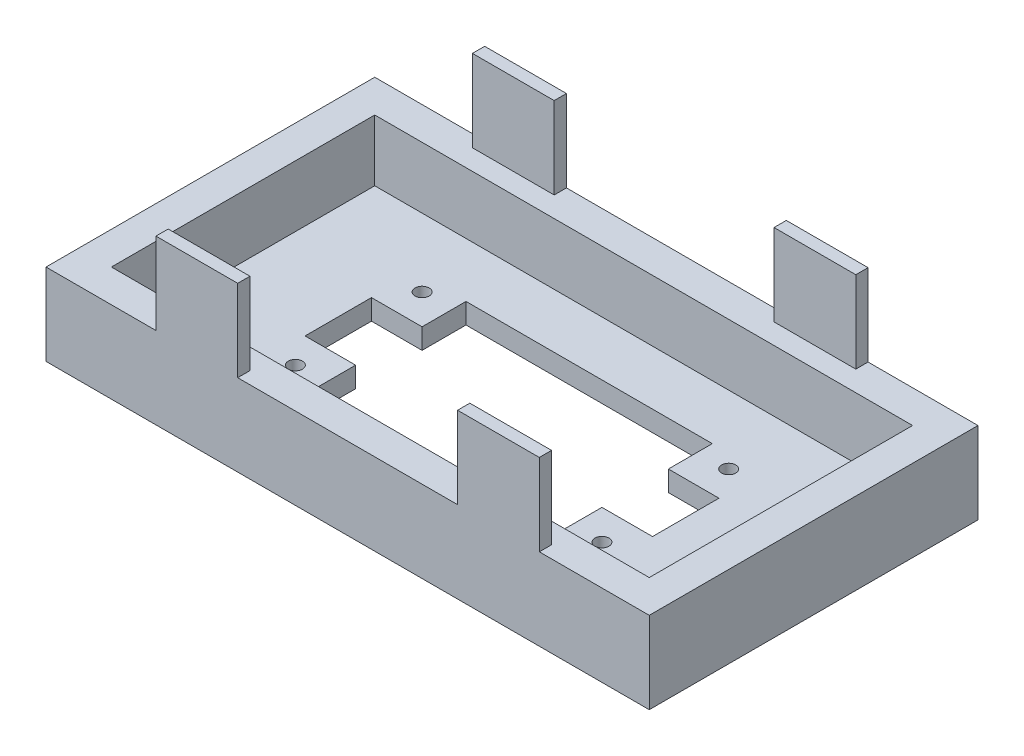
from build123d import *

# Parameters (mm, degrees)
SKETCH1_W                                           = 147.57
SKETCH1_H                                           = 80.42
BOSS_EXTRUDE1_DEPTH                                 = 20
SKETCH2_W                                           = 131.57
SKETCH2_H                                           = 64.42
CUT_EXTRUDE1_DEPTH                                  = 15
CBORE_FOR_4_BINDING_HEAD_MACHINE_SCREW1_D           = 3.4544
CBORE_FOR_4_BINDING_HEAD_MACHINE_SCREW1_CBORE_D     = 6.74624
CBORE_FOR_4_BINDING_HEAD_MACHINE_SCREW1_CBORE_DEPTH = 1.7272
CUT_EXTRUDE2_DEPTH                                  = 170.246215024
SKETCH6_W                                           = 20
SKETCH6_H                                           = 3
BOSS_EXTRUDE2_DEPTH                                 = 20
MIRROR2_COPY_1_SKETCH_W                             = 20
MIRROR2_COPY_1_SKETCH_H                             = 3
MIRROR2_COPY_1_DEPTH                                = 20


with BuildPart() as part:
    # Sketch1 → Boss-Extrude1 (new body)
    with BuildSketch(Plane(origin=(0, 0, 0), x_dir=(1, 0, 0), z_dir=(0, 1, 0))):
        with Locations((73.785, 40.21)):
            Rectangle(SKETCH1_W, SKETCH1_H)
    extrude(amount=BOSS_EXTRUDE1_DEPTH)

    # Sketch2 → Cut-Extrude1 (cut)
    with BuildSketch(Plane(origin=(0, 20, 0), x_dir=(1, 0, 0), z_dir=(0, 1, 0))):
        with Locations((73.785, 40.21)):
            Rectangle(SKETCH2_W, SKETCH2_H)
    extrude(amount=-CUT_EXTRUDE1_DEPTH, mode=Mode.SUBTRACT)

    # CBORE for #4 Binding Head Machine Screw1 (through all)
    with Locations(Plane(origin=(36.285, 0, -24.71), x_dir=(0, 0, -1), z_dir=(0, -1, 0))):
        with Locations((0, 0), (31, 0), (0, 75), (31, 75)):
            CounterBoreHole(CBORE_FOR_4_BINDING_HEAD_MACHINE_SCREW1_D / 2, CBORE_FOR_4_BINDING_HEAD_MACHINE_SCREW1_CBORE_D / 2, CBORE_FOR_4_BINDING_HEAD_MACHINE_SCREW1_CBORE_DEPTH)

    # Sketch5 → Cut-Extrude2 (cut, through all)
    with BuildSketch(Plane.XZ):
        Polygon((103.91188, -32.08312), (103.91188, -21.33688), (43.65812, -21.33688), (43.65812, -32.08312), (31.285, -32.08312), (31.285, -48.33688), (43.65812, -48.33688), (43.65812, -59.08312), (103.91188, -59.08312), (103.91188, -48.33688), (116.285, -48.33688), (116.285, -32.08312), align=None)
    extrude(amount=-CUT_EXTRUDE2_DEPTH, mode=Mode.SUBTRACT)

    # Sketch6 → Boss-Extrude2 (add)
    with BuildSketch(Plane(origin=(0, 20, 0), x_dir=(1, 0, 0), z_dir=(0, 1, 0))):
        with Locations((36.8925, 78.92)):
            Rectangle(SKETCH6_W, SKETCH6_H)
    boss_extrude2 = extrude(amount=BOSS_EXTRUDE2_DEPTH)

    # Mirror1: Boss-Extrude2 across plane
    add(boss_extrude2.mirror(Plane(origin=(73.785, 0, 0), x_dir=(0, 0, 1), z_dir=(1, 0, 0))))

    # Mirror2: Boss-Extrude2 across plane
    add(boss_extrude2.mirror(Plane(origin=(0, 0, -40.21), x_dir=(1, 0, 0), z_dir=(0, 0, -1))))

    # Mirror2 copy 1 sketch → Mirror2 copy 1 (add)
    with BuildSketch(Plane(origin=(147.57, 20, -80.42), x_dir=(-1, 0, 0), z_dir=(0, 1, 0))):
        with Locations((36.8925, 78.92)):
            Rectangle(MIRROR2_COPY_1_SKETCH_W, MIRROR2_COPY_1_SKETCH_H)
    extrude(amount=MIRROR2_COPY_1_DEPTH)


solid = part.part
